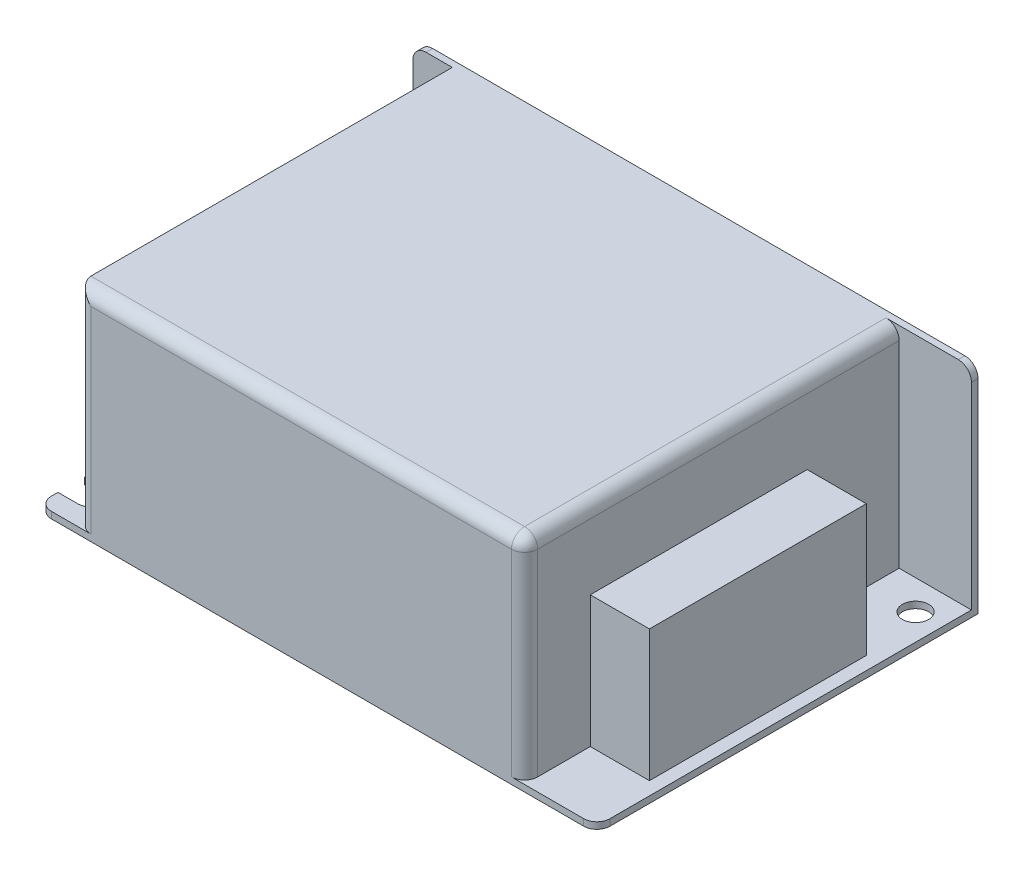
from build123d import *

# Parameters (mm, degrees)
SKETCH1_W           = 85
SKETCH1_H           = 58
BOSS_EXTRUDE1_DEPTH = 33
SKETCH2_W           = 11
SKETCH2_H           = 57
CUT_EXTRUDE1_DEPTH  = 32
SKETCH3_W           = 6
SKETCH3_H           = 57
CUT_EXTRUDE2_DEPTH  = 32
SKETCH4_W           = 9
SKETCH4_H           = 33
BOSS_EXTRUDE2_DEPTH = 20
CUT_EXTRUDE3_REACH  = 63.125
FILLET1_R           = 2


with BuildPart() as part:
    # Sketch1 → Boss-Extrude1 (new body)
    with BuildSketch(Plane(origin=(0, 0, 0), x_dir=(1, 0, 0), z_dir=(0, 1, 0))):
        Rectangle(SKETCH1_W, SKETCH1_H)
    extrude(amount=BOSS_EXTRUDE1_DEPTH)

    # Sketch2 → Cut-Extrude1 (cut)
    with BuildSketch(Plane(origin=(0, 33, 0), x_dir=(1, 0, 0), z_dir=(0, 1, 0))):
        with Locations((37, -0.5)):
            Rectangle(SKETCH2_W, SKETCH2_H)
    extrude(amount=-CUT_EXTRUDE1_DEPTH, mode=Mode.SUBTRACT)

    # Sketch3 → Cut-Extrude2 (cut)
    with BuildSketch(Plane(origin=(0, 33, 0), x_dir=(1, 0, 0), z_dir=(0, 1, 0))):
        with Locations((-39.5, -0.5)):
            Rectangle(SKETCH3_W, SKETCH3_H)
    extrude(amount=-CUT_EXTRUDE2_DEPTH, mode=Mode.SUBTRACT)

    # Sketch4 → Boss-Extrude2 (add)
    with BuildSketch(Plane(origin=(0, 1, 0), x_dir=(1, 0, 0), z_dir=(0, 1, 0))):
        with Locations((36, -2.5)):
            Rectangle(SKETCH4_W, SKETCH4_H)
    extrude(amount=BOSS_EXTRUDE2_DEPTH)

    # Sketch5 → Cut-Extrude3 (cut, up to next)
    with BuildSketch(Plane.XZ, mode=Mode.PRIVATE) as cut_extrude3_sk1:
        with BuildLine():
            Line((38.5, -25.5), (38.5, -23.5))
            Line((38.5, -23.5), (40.5, -23.5))
            ThreePointArc((40.5, -23.5), (37.085786438, -22.085786438), (38.5, -25.5))
        make_face()
    cut_extrude3_tool1 = extrude(cut_extrude3_sk1.sketch, amount=-CUT_EXTRUDE3_REACH, mode=Mode.PRIVATE) & part.part
    # Sketch5 → Cut-Extrude3 (cut, up to next)
    with BuildSketch(Plane.XZ, mode=Mode.PRIVATE) as cut_extrude3_sk2:
        with BuildLine():
            Line((40.5, -23.5), (38.5, -23.5))
            Line((38.5, -23.5), (38.5, -25.5))
            ThreePointArc((38.5, -25.5), (39.914213562, -24.914213562), (40.5, -23.5))
        make_face()
    cut_extrude3_tool2 = extrude(cut_extrude3_sk2.sketch, amount=-CUT_EXTRUDE3_REACH, mode=Mode.PRIVATE) & part.part
    # Sketch5 → Cut-Extrude3 (cut, up to next)
    with BuildSketch(Plane.XZ, mode=Mode.PRIVATE) as cut_extrude3_sk3:
        with BuildLine():
            Line((38.5, -25.5), (38.5, -23.5))
            Line((38.5, -23.5), (40.5, -23.5))
            ThreePointArc((40.5, -23.5), (37.085786438, -22.085786438), (38.5, -25.5))
        make_face()
    cut_extrude3_tool3 = extrude(cut_extrude3_sk3.sketch, amount=-CUT_EXTRUDE3_REACH, mode=Mode.PRIVATE) & part.part
    # Sketch5 → Cut-Extrude3 (cut, up to next)
    with BuildSketch(Plane.XZ, mode=Mode.PRIVATE) as cut_extrude3_sk4:
        with BuildLine():
            Line((40.5, -23.5), (38.5, -23.5))
            Line((38.5, -23.5), (38.5, -25.5))
            ThreePointArc((38.5, -25.5), (39.914213562, -24.914213562), (40.5, -23.5))
        make_face()
    cut_extrude3_tool4 = extrude(cut_extrude3_sk4.sketch, amount=-CUT_EXTRUDE3_REACH, mode=Mode.PRIVATE) & part.part
    # Sketch5 → Cut-Extrude3 (cut, up to next)
    with BuildSketch(Plane.XZ, mode=Mode.PRIVATE) as cut_extrude3_sk5:
        with BuildLine():
            Line((-39.5, 22), (-42.5, 22))
            ThreePointArc((-42.5, 22), (-44.5, 24), (-42.5, 26))
            Line((-42.5, 26), (-39.5, 26))
            ThreePointArc((-39.5, 26), (-37.5, 24), (-39.5, 22))
        make_face()
    cut_extrude3_tool5 = extrude(cut_extrude3_sk5.sketch, amount=-CUT_EXTRUDE3_REACH, mode=Mode.PRIVATE) & part.part
    add(cut_extrude3_tool1.solids().sort_by_distance((38.217058, 0, -23.217058))[0], mode=Mode.SUBTRACT)
    add(cut_extrude3_tool2.solids().sort_by_distance((39.348826, 0, -24.348826))[0], mode=Mode.SUBTRACT)
    add(cut_extrude3_tool3.solids().sort_by_distance((38.217058, 0, -23.217058))[0], mode=Mode.SUBTRACT)
    add(cut_extrude3_tool4.solids().sort_by_distance((39.348826, 0, -24.348826))[0], mode=Mode.SUBTRACT)
    add(cut_extrude3_tool5.solids().sort_by_distance((-41, 0, 24))[0], mode=Mode.SUBTRACT)

    # Fillet1
    fillet1_edges = [part.edges().sort_by_distance(p)[0] for p in [
        (-42.5, 33, -28.5),
        (42.5, 33, -28.5),
        (42.5, 0.5, 29),
        (31.5, 33, 0.5),
        (31.5, 17, 29),
        (-2.5, 33, 29),
        (-42.5, 0.5, 29),
        (-36.5, 17, 29),
    ]]
    fillet(fillet1_edges, radius=FILLET1_R)


solid = part.part
